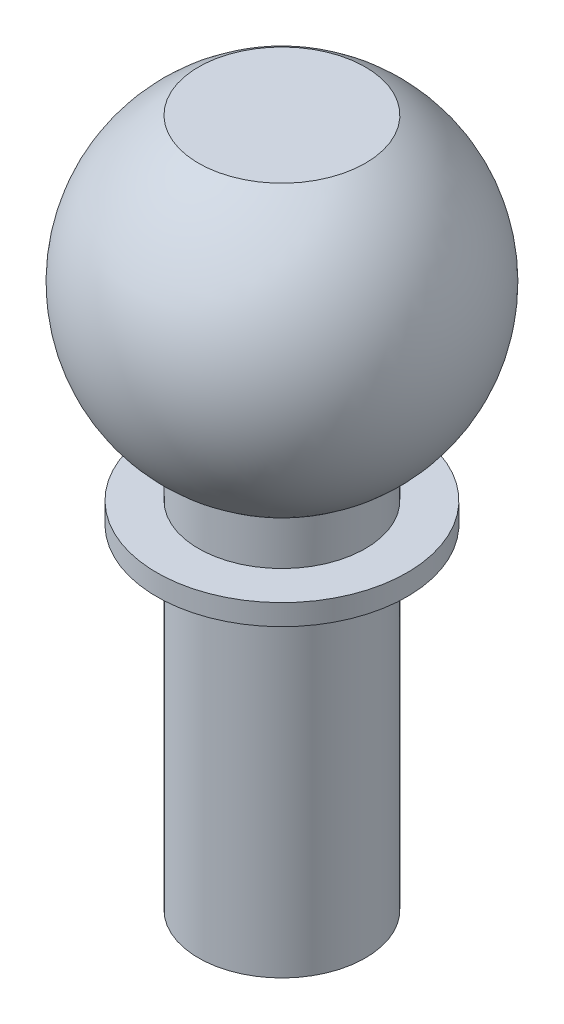
from build123d import *


with BuildPart() as part:
    # Sketch1 → Revolve1 (revolve)
    with BuildSketch(Plane.XY, mode=Mode.PRIVATE) as revolve1_sk:
        with BuildLine():
            Line((0, 0), (20, 0))
            Line((20, 0), (20, 80))
            Line((20, 80), (30, 80))
            Line((30, 80), (30, 85))
            Line((30, 85), (20, 85))
            Line((20, 85), (20, 95.717967697))
            ThreePointArc((20, 95.717967697), (40, 130.358983849), (20, 165))
            Line((20, 165), (0, 165))
            Line((0, 165), (0, 0))
        make_face()
    revolve(revolve1_sk.sketch.rotate(Axis((0, 0, 0), (0, 1, 0)), 90), axis=Axis((0, 0, 0), (0, 1, 0)))


solid = part.part
